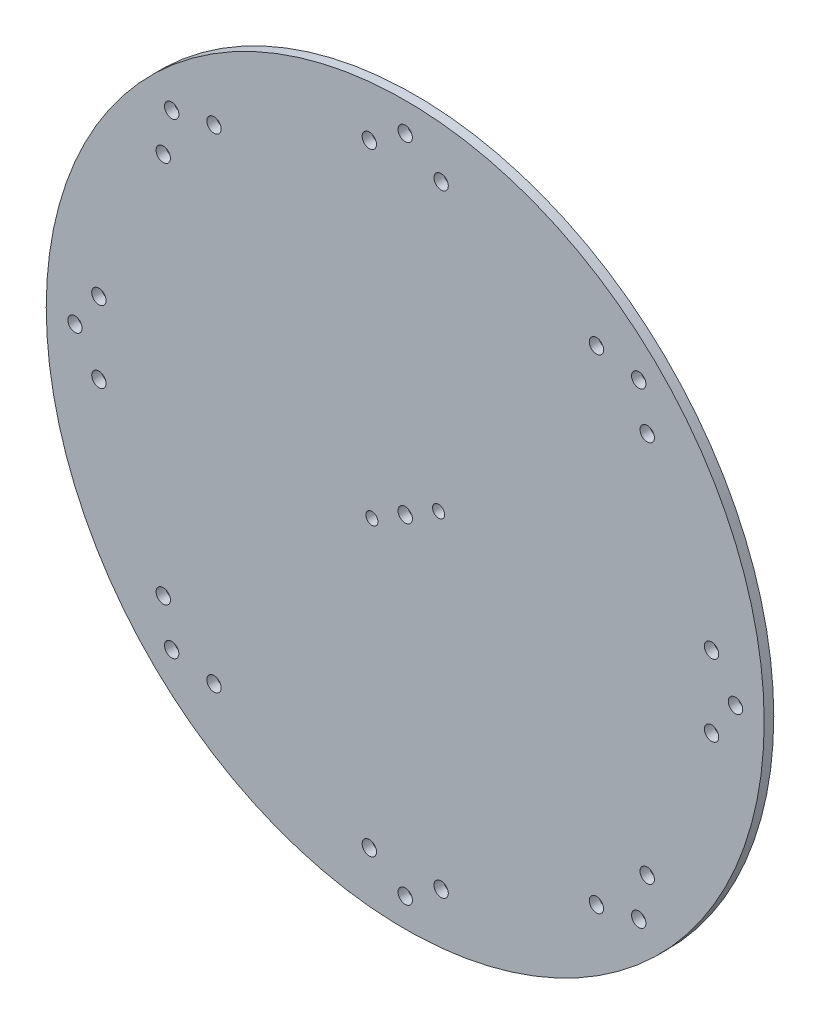
from build123d import *

# Parameters (mm, degrees)
SKETCH1_R           = 75
BOSS_EXTRUDE3_DEPTH = 2
SKETCH2_R           = 1.5
CUT_EXTRUDE1_DEPTH  = 2
CIRPATTERN2_COUNT   = 8
SKETCH3_R           = 1.5
BOSS_EXTRUDE4_DEPTH = 2
SKETCH4_R           = 1.264823641
CUT_EXTRUDE2_DEPTH  = 10


with BuildPart() as part:
    # Sketch1 → Boss-Extrude3 (new body)
    with BuildSketch(Plane.XY):
        with Locations((6.9, 0)):
            Circle(SKETCH1_R)
        with BuildLine():
            Line((9.3, 1.8), (9.3, -1.8))
            ThreePointArc((9.3, -1.8), (3.9, 0), (9.3, 1.8))
        make_face(mode=Mode.SUBTRACT)
    extrude(amount=BOSS_EXTRUDE3_DEPTH)

    # Sketch2 → Cut-Extrude1 (cut)
    with BuildSketch(Plane.XY.offset(2)):
        with Locations((75.9, 0)):
            Circle(SKETCH2_R)
        with Locations((70.9, -7.5)):
            Circle(SKETCH2_R)
        with Locations((70.9, 7.5)):
            Circle(SKETCH2_R)
    cut_extrude1 = extrude(amount=-CUT_EXTRUDE1_DEPTH, mode=Mode.SUBTRACT)

    # CirPattern2: Cut-Extrude1 ×8 about axis
    cirpattern2_axis = Axis((6.9, 0, 0), (0, 0, 1))
    for i in range(1, CIRPATTERN2_COUNT):
        add(cut_extrude1.rotate(cirpattern2_axis, i * 360 / CIRPATTERN2_COUNT), mode=Mode.SUBTRACT)

    # Sketch3 → Boss-Extrude4 (add)
    with BuildSketch(Plane(origin=(0, 0, 0), x_dir=(-1, 0, 0), z_dir=(0, 0, -1))):
        with BuildLine():
            Line((-9.3, -1.8), (-9.3, 1.8))
            ThreePointArc((-9.3, 1.8), (-3.9, 0), (-9.3, -1.8))
        make_face()
        with Locations((-6.9, 0)):
            Circle(SKETCH3_R, mode=Mode.SUBTRACT)
    extrude(amount=-BOSS_EXTRUDE4_DEPTH)

    # Sketch4 → Cut-Extrude2 (cut)
    with BuildSketch(Plane.XY.offset(2)):
        with Locations((13.868293577, 4.129513848)):
            Circle(SKETCH4_R)
        with Locations((-0.068293577, -4.129513848)):
            Circle(SKETCH4_R)
    extrude(amount=-CUT_EXTRUDE2_DEPTH, mode=Mode.SUBTRACT)


solid = part.part
